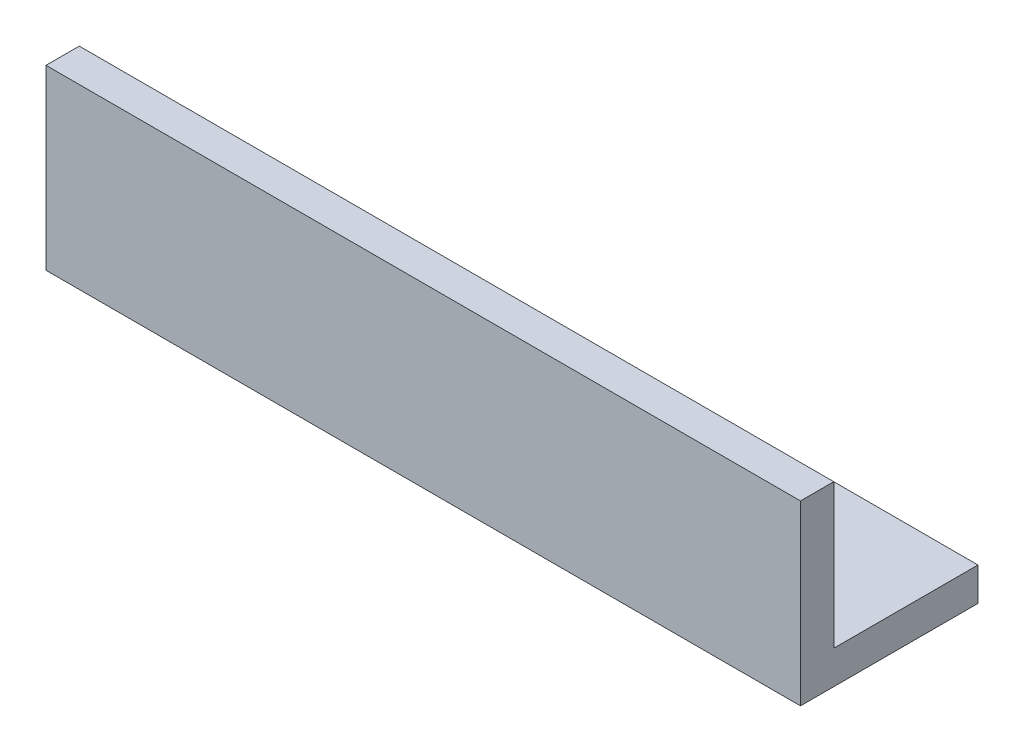
from build123d import *

# Parameters (mm, degrees)
BOSS_EXTRUDE1_DEPTH = 107.95
CUT_EXTRUDE1_REACH  = 114.802
SKETCH2_R           = 3.175
CUT_EXTRUDE2_REACH  = 115.77
SKETCH3_R           = 3.175


with BuildPart() as part:
    # Sketch1 → Boss-Extrude1 (new body)
    with BuildSketch(Plane(origin=(0, 0, 0), x_dir=(0, 0, -1), z_dir=(1, 0, 0))):
        Polygon((0, 0), (0, -25.4), (25.4, -25.4), (25.4, -20.6375), (4.7625, -20.6375), (4.7625, 0), align=None)
    extrude(amount=BOSS_EXTRUDE1_DEPTH)

    # Sketch2 → Cut-Extrude1 (cut, up to next)
    with BuildSketch(Plane(origin=(0, -20.6375, 0), x_dir=(1, 0, 0), z_dir=(0, 1, 0)), mode=Mode.PRIVATE) as cut_extrude1_sk1:
        with Locations(Location((9.525, 11.1125, 0), (0, 0, 270))):
            Circle(SKETCH2_R)
    cut_extrude1_tool1 = extrude(cut_extrude1_sk1.sketch, amount=-CUT_EXTRUDE1_REACH, mode=Mode.PRIVATE) & part.part
    # Sketch2 → Cut-Extrude1 (cut, up to next)
    with BuildSketch(Plane(origin=(0, -20.6375, 0), x_dir=(1, 0, 0), z_dir=(0, 1, 0)), mode=Mode.PRIVATE) as cut_extrude1_sk2:
        with Locations(Location((19.05, 17.4625, 0), (0, 0, 270))):
            Circle(SKETCH2_R)
    cut_extrude1_tool2 = extrude(cut_extrude1_sk2.sketch, amount=-CUT_EXTRUDE1_REACH, mode=Mode.PRIVATE) & part.part
    add(cut_extrude1_tool1.solids().sort_by_distance((9.525, -20.6375, -11.1125))[0], mode=Mode.SUBTRACT)
    add(cut_extrude1_tool2.solids().sort_by_distance((19.05, -20.6375, -17.4625))[0], mode=Mode.SUBTRACT)

    # Sketch3 → Cut-Extrude2 (cut, up to next)
    with BuildSketch(Plane.XZ.offset(25.4), mode=Mode.PRIVATE) as cut_extrude2_sk1:
        with Locations(Location((76.332177029, -13.470384182, 0), (0, 0, 270))):
            Circle(SKETCH3_R)
    cut_extrude2_tool1 = extrude(cut_extrude2_sk1.sketch, amount=-CUT_EXTRUDE2_REACH, mode=Mode.PRIVATE) & part.part
    add(cut_extrude2_tool1.solids().sort_by_distance((76.332177, -25.4, -13.470384))[0], mode=Mode.SUBTRACT)


solid = part.part
